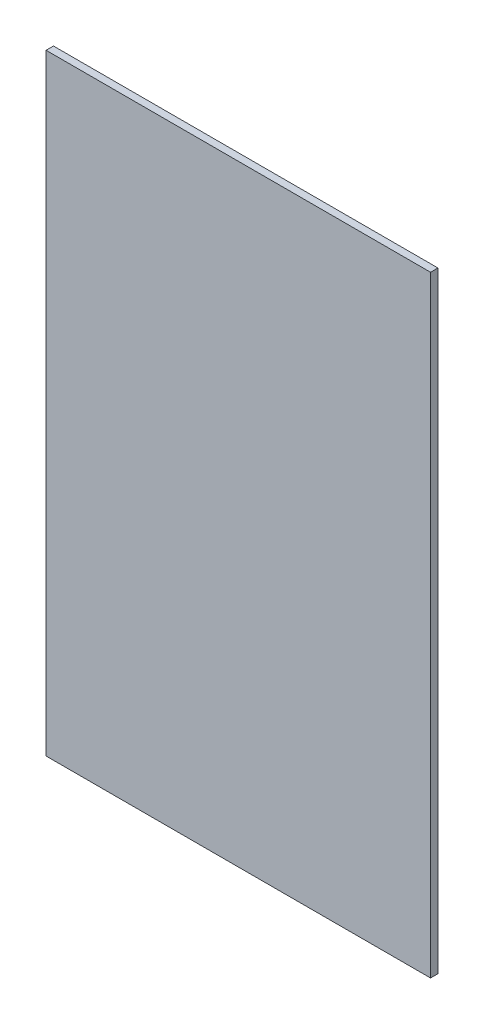
from build123d import *

# Parameters (mm, degrees)
ESQUISSE1_W        = 156
ESQUISSE1_H        = 248
BOSS_EXTRU_1_DEPTH = 3


with BuildPart() as part:
    # Esquisse1 → Boss.-Extru.1 (new body)
    with BuildSketch(Plane.XY):
        with Locations((78.917030568, 72.493449782)):
            Rectangle(ESQUISSE1_W, ESQUISSE1_H)
    extrude(amount=BOSS_EXTRU_1_DEPTH)


solid = part.part
